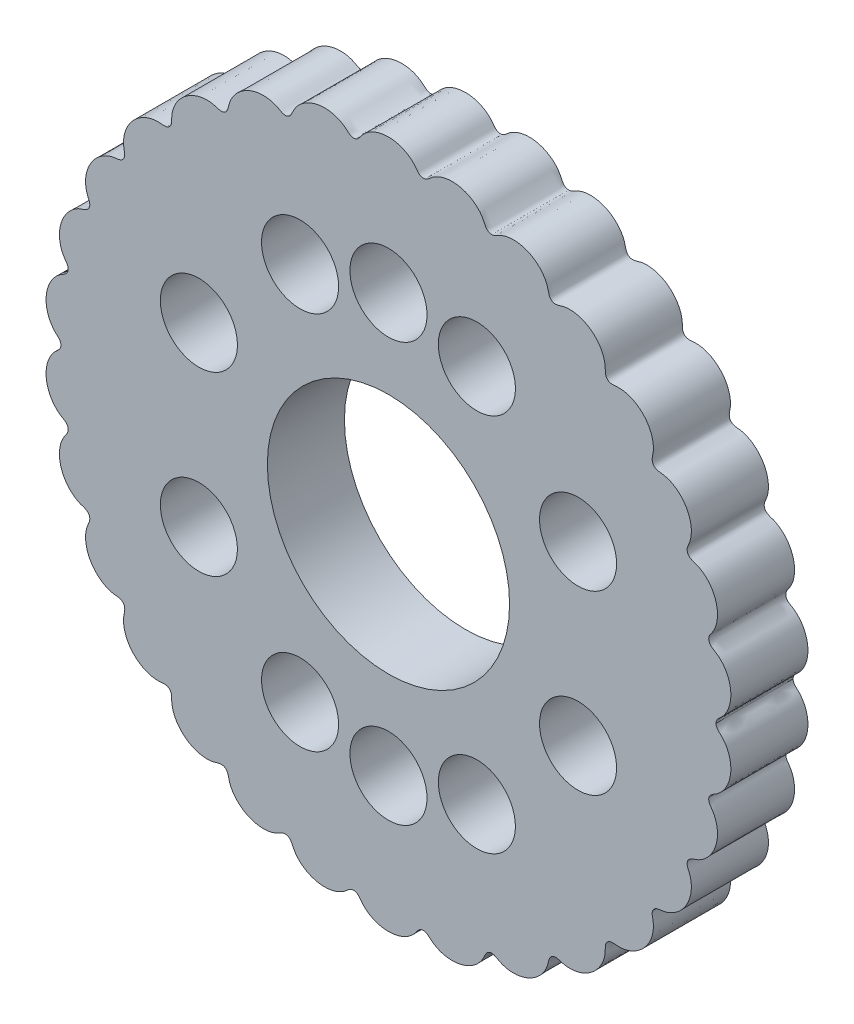
from build123d import *

# Parameters (mm, degrees)
BOSS_EXTRU_1_DEPTH      = 7
ESQUISSE2_R             = 3.5
ESQUISSE2_R_2           = 11
ENL_V_MAT_EXTRU_1_DEPTH = 45.638751691


with BuildPart() as part:
    # Esquisse1 → Boss.-Extru.1 (new body)
    with BuildSketch(Plane.XY):
        with BuildLine():
            add(Edge.make_bspline(
                [(29.75, 0), (29.75, -0.140597317), (29.868141552, -0.421461557), (30.323728325, -0.778551317), (30.756059113, -1.360631901), (31.05528351, -2.175436877), (31.1311911, -3.039210716), (30.990585079, -3.894473922), (30.697291766, -4.555148986), (30.36186421, -5.022144822), (30.060775877, -5.330577748), (29.717846033, -5.592712113), (29.328538855, -5.782182254), (29.049792204, -6.141427792), (29.111562517, -6.597079384), (29.389901644, -6.932142165), (29.605756987, -7.304556503), (29.763326521, -7.706225348), (29.890581441, -8.266803983), (29.902367273, -8.989748333), (29.697008207, -9.831679599), (29.289195496, -10.597300184), (28.696108316, -11.229222627), (28.071702237, -11.603099513), (27.513860316, -11.745290086), (27.153595417, -12.01834534), (27.094633413, -12.476886731), (27.294073027, -12.865586826), (27.433341475, -13.272169368), (27.532867261, -13.83914708), (27.496449686, -14.561800198), (27.228816643, -15.386455528), (26.764531631, -16.118443702), (26.236468325, -16.61186626), (25.745602358, -16.911413725), (25.348623221, -17.078579019), (24.930243872, -17.188384684), (24.500217935, -17.207149826), (24.083804251, -17.377842841), (23.906848881, -17.807350624), (24.015247501, -18.231768991), (24.073447524, -18.656891554), (24.062056853, -19.08873021), (23.961398047, -19.654539591), (23.689675117, -20.32471612), (23.171173996, -21.019306273), (22.608883954, -21.47280356), (22.099971556, -21.74022471), (21.559984305, -21.93443999), (20.982281642, -22.017883352), (20.416041208, -21.930735471), (19.972021705, -21.988439699), (19.688462786, -22.358972522), (19.69790625, -22.798005124), (19.673174245, -23.225799304), (19.543724586, -23.787387211), (19.229151848, -24.438621475), (18.660017359, -25.093061515), (17.946397928, -25.584588147), (17.131418747, -25.882955741), (16.410791008, -25.938043434), (15.839458095, -25.855825215), (15.437343422, -25.707694829), (14.994659593, -25.651417476), (14.623488937, -25.936605654), (14.530838201, -26.366842479), (14.424788701, -26.78151288), (14.245602688, -27.175160055), (13.933225228, -27.657279928), (13.42101245, -28.168198322), (12.672236724, -28.604290578), (11.837778732, -28.841668679), (10.972095571, -28.855360209), (10.266577085, -28.66935197), (9.778355486, -28.372966253), (9.365747914, -28.207683461), (8.932323413, -28.387404231), (8.740197599, -28.784607909), (8.556885887, -29.170933655), (8.218275705, -29.63802323), (7.675546763, -30.115566718), (6.895499115, -30.495235047), (6.046463762, -30.668270941), (5.179841061, -30.624062878), (4.494438496, -30.394918661), (4.000166127, -30.096703374), (3.68505546, -29.807717775), (3.326944679, -29.546190998), (2.861199415, -29.607519812), (2.579043887, -29.947765715), (2.239300608, -30.40625765), (1.663361794, -30.853093305), (0.860435788, -31.177849944), (3.305e-06, -31.28607424), (-0.860438264, -31.177852117), (-1.663337129, -30.853084694), (-2.239345562, -30.406277477), (-2.578974817, -29.947730674), (-2.861199778, -29.607527006), (-3.326939684, -29.546188057), (-3.685051978, -29.807717556), (-4.000165501, -30.096703111), (-4.494438307, -30.394918698), (-5.17984122, -30.624062885), (-6.046463749, -30.668270945), (-6.895499126, -30.495235047), (-7.675546761, -30.115566719), (-8.218275704, -29.638023229), (-8.556885888, -29.170933655), (-8.740197599, -28.784607909), (-8.932323413, -28.387404231), (-9.365747914, -28.207683461), (-9.778355486, -28.372966253), (-10.266577085, -28.66935197), (-10.972095571, -28.855360209), (-11.837778732, -28.841668678), (-12.672236724, -28.604290578), (-13.42101245, -28.168198322), (-13.933225228, -27.657279928), (-14.245602688, -27.175160055), (-14.424788701, -26.78151288), (-14.530838201, -26.366842479), (-14.623488937, -25.936605654), (-14.994659593, -25.651417476), (-15.437343422, -25.707694829), (-15.839458095, -25.855825215), (-16.410791008, -25.938043434), (-17.131418747, -25.882955741), (-17.946397928, -25.584588147), (-18.660017359, -25.093061515), (-19.229151848, -24.438621475), (-19.543724586, -23.787387211), (-19.673174245, -23.225799304), (-19.69790625, -22.798005124), (-19.688462786, -22.358972522), (-19.972021705, -21.988439699), (-20.416041208, -21.930735471), (-20.982281642, -22.017883352), (-21.559984305, -21.93443999), (-22.099971556, -21.74022471), (-22.608883954, -21.47280356), (-23.171173996, -21.019306273), (-23.689675117, -20.32471612), (-23.961398047, -19.654539591), (-24.062056853, -19.08873021), (-24.073447524, -18.656891554), (-24.015247501, -18.231768991), (-23.906848881, -17.807350624), (-24.083804251, -17.377842841), (-24.500217935, -17.207149826), (-24.930243872, -17.188384684), (-25.348623221, -17.078579019), (-25.745602358, -16.911413725), (-26.236468325, -16.61186626), (-26.764531631, -16.118443702), (-27.228816643, -15.386455528), (-27.496449686, -14.561800198), (-27.532867261, -13.83914708), (-27.433341475, -13.272169368), (-27.294073027, -12.865586826), (-27.094633413, -12.476886731), (-27.153595417, -12.01834534), (-27.513860316, -11.745290086), (-28.071702237, -11.603099513), (-28.696108316, -11.229222627), (-29.289195496, -10.597300184), (-29.697008207, -9.831679599), (-29.902367273, -8.989748333), (-29.890581441, -8.266803983), (-29.763326521, -7.706225348), (-29.605756987, -7.304556503), (-29.389901644, -6.932142165), (-29.111562517, -6.597079384), (-29.049792204, -6.141427792), (-29.328538855, -5.782182254), (-29.717846035, -5.592712108), (-30.060775874, -5.330577753), (-30.361864232, -5.022144787), (-30.697291735, -4.555149037), (-30.990585034, -3.894473995), (-31.131191105, -3.039210707), (-31.05528297, -2.175437752), (-30.756059941, -1.360630553), (-30.32372715, -0.778553246), (-29.868141764, -0.421461177), (-29.75, -0.140597316), (-29.75, 0)],
                knots=[0.074015259, 0.074015259, 0.074015259, 0.074015259, 0.077343265, 0.080671271, 0.087327283, 0.093983294, 0.100639306, 0.107295317, 0.113951329, 0.117279335, 0.12060734, 0.123935346, 0.127263352, 0.130591358, 0.133919364, 0.137247369, 0.140575375, 0.143903381, 0.147231387, 0.153887398, 0.16054341, 0.167199421, 0.173855433, 0.180511445, 0.18383945, 0.187167456, 0.190495462, 0.193823468, 0.197151474, 0.200479479, 0.207135491, 0.213791502, 0.220447514, 0.227103526, 0.230431531, 0.233759537, 0.237087543, 0.240415549, 0.243743555, 0.24707156, 0.250399566, 0.253727572, 0.257055578, 0.260383583, 0.267039595, 0.273695607, 0.280351618, 0.283679624, 0.28700763, 0.293663641, 0.296991647, 0.300319653, 0.303647659, 0.306975664, 0.31030367, 0.313631676, 0.320287688, 0.326943699, 0.333599711, 0.340255722, 0.346911734, 0.35023974, 0.353567745, 0.356895751, 0.360223757, 0.363551763, 0.366879769, 0.370207774, 0.37353578, 0.380191792, 0.386847803, 0.393503815, 0.400159826, 0.406815838, 0.410143844, 0.41347185, 0.416799855, 0.420127861, 0.423455867, 0.426783873, 0.433439884, 0.440095896, 0.446751907, 0.453407919, 0.460063931, 0.463391936, 0.466719942, 0.470047948, 0.473375954, 0.47670396, 0.480031965, 0.486687977, 0.493343988, 0.5, 0.506656012, 0.513312023, 0.519968035, 0.52329604, 0.526624046, 0.529952052, 0.533280058, 0.536608064, 0.539936069, 0.546592081, 0.553248093, 0.559904104, 0.566560116, 0.573216127, 0.576544133, 0.579872139, 0.583200145, 0.58652815, 0.589856156, 0.593184162, 0.599840174, 0.606496185, 0.613152197, 0.619808208, 0.62646422, 0.629792226, 0.633120231, 0.636448237, 0.639776243, 0.643104249, 0.646432255, 0.64976026, 0.653088266, 0.659744278, 0.666400289, 0.673056301, 0.679712312, 0.686368324, 0.68969633, 0.693024336, 0.696352341, 0.699680347, 0.703008353, 0.706336359, 0.71299237, 0.716320376, 0.719648382, 0.726304393, 0.732960405, 0.739616417, 0.742944422, 0.746272428, 0.749600434, 0.75292844, 0.756256445, 0.759584451, 0.762912457, 0.766240463, 0.769568469, 0.772896474, 0.779552486, 0.786208498, 0.792864509, 0.799520521, 0.802848526, 0.806176532, 0.809504538, 0.812832544, 0.81616055, 0.819488555, 0.826144567, 0.832800579, 0.83945659, 0.846112602, 0.852768613, 0.856096619, 0.859424625, 0.862752631, 0.866080636, 0.869408642, 0.872736648, 0.876064654, 0.87939266, 0.882720665, 0.886048671, 0.892704683, 0.899360694, 0.906016706, 0.912672717, 0.919328729, 0.922656735, 0.925984741, 0.925984741, 0.925984741, 0.925984741], degree=3))
            add(Edge.make_bspline(
                [(-29.75, 0), (-29.75, 0.140597316), (-29.868141764, 0.421461177), (-30.32372715, 0.778553246), (-30.756059941, 1.360630553), (-31.05528297, 2.175437752), (-31.131191105, 3.039210707), (-30.990585034, 3.894473995), (-30.697291735, 4.555149037), (-30.361864232, 5.022144787), (-30.060775874, 5.330577753), (-29.717846035, 5.592712108), (-29.328538855, 5.782182254), (-29.049792204, 6.141427792), (-29.111562517, 6.597079384), (-29.389901644, 6.932142165), (-29.605756987, 7.304556503), (-29.763326521, 7.706225348), (-29.890581441, 8.266803983), (-29.902367273, 8.989748333), (-29.697008207, 9.831679599), (-29.289195496, 10.597300184), (-28.696108316, 11.229222627), (-28.071702237, 11.603099513), (-27.513860316, 11.745290086), (-27.153595417, 12.01834534), (-27.094633413, 12.476886731), (-27.294073027, 12.865586826), (-27.433341475, 13.272169368), (-27.532867261, 13.83914708), (-27.496449686, 14.561800198), (-27.228816643, 15.386455528), (-26.764531631, 16.118443702), (-26.236468325, 16.61186626), (-25.745602358, 16.911413725), (-25.348623221, 17.078579019), (-24.930243872, 17.188384684), (-24.500217935, 17.207149826), (-24.083804251, 17.377842841), (-23.906848881, 17.807350624), (-24.015247501, 18.231768991), (-24.073447524, 18.656891554), (-24.062056853, 19.08873021), (-23.961398047, 19.654539591), (-23.689675117, 20.32471612), (-23.171173996, 21.019306273), (-22.608883954, 21.47280356), (-22.099971556, 21.74022471), (-21.559984305, 21.93443999), (-20.982281642, 22.017883352), (-20.416041208, 21.930735471), (-19.972021705, 21.988439699), (-19.688462786, 22.358972522), (-19.69790625, 22.798005124), (-19.673174245, 23.225799304), (-19.543724586, 23.787387211), (-19.229151848, 24.438621475), (-18.660017359, 25.093061515), (-17.946397928, 25.584588147), (-17.131418747, 25.882955741), (-16.410791008, 25.938043434), (-15.839458095, 25.855825215), (-15.437343422, 25.707694829), (-14.994659593, 25.651417476), (-14.623488937, 25.936605654), (-14.530838201, 26.366842479), (-14.424788701, 26.78151288), (-14.245602688, 27.175160055), (-13.933225228, 27.657279928), (-13.42101245, 28.168198322), (-12.672236724, 28.604290578), (-11.837778732, 28.841668678), (-10.972095571, 28.855360209), (-10.266577085, 28.669351969), (-9.778355486, 28.372966253), (-9.365747914, 28.207683461), (-8.932323413, 28.387404231), (-8.740197599, 28.784607909), (-8.556885888, 29.170933655), (-8.218275704, 29.638023229), (-7.675546761, 30.115566719), (-6.895499126, 30.495235047), (-6.046463749, 30.668270945), (-5.17984122, 30.624062885), (-4.494438307, 30.394918698), (-4.000165501, 30.096703111), (-3.685051978, 29.807717556), (-3.326939684, 29.546188057), (-2.861199778, 29.607527006), (-2.578974817, 29.947730674), (-2.239345562, 30.406277477), (-1.663337129, 30.853084694), (-0.860438264, 31.177852117), (3.305e-06, 31.28607424), (0.860435788, 31.177849944), (1.663361794, 30.853093305), (2.239300608, 30.40625765), (2.579043887, 29.947765715), (2.861199415, 29.607519812), (3.326944679, 29.546190998), (3.68505546, 29.807717775), (4.000166127, 30.096703374), (4.494438496, 30.394918661), (5.179841061, 30.624062878), (6.046463762, 30.668270941), (6.895499115, 30.495235047), (7.675546763, 30.115566718), (8.218275705, 29.63802323), (8.556885887, 29.170933655), (8.740197599, 28.784607909), (8.932323413, 28.387404231), (9.365747914, 28.207683461), (9.778355486, 28.372966253), (10.266577085, 28.66935197), (10.972095571, 28.855360209), (11.837778732, 28.841668678), (12.672236724, 28.604290578), (13.42101245, 28.168198322), (13.933225228, 27.657279928), (14.245602688, 27.175160055), (14.424788701, 26.78151288), (14.530838201, 26.366842479), (14.623488937, 25.936605654), (14.994659593, 25.651417476), (15.437343422, 25.707694829), (15.839458095, 25.855825215), (16.410791008, 25.938043434), (17.131418747, 25.882955741), (17.946397928, 25.584588147), (18.660017359, 25.093061515), (19.229151848, 24.438621475), (19.543724586, 23.787387211), (19.673174245, 23.225799304), (19.69790625, 22.798005124), (19.688462786, 22.358972522), (19.972021705, 21.988439699), (20.416041208, 21.930735471), (20.982281642, 22.017883352), (21.559984305, 21.93443999), (22.099971556, 21.74022471), (22.608883954, 21.47280356), (23.171173996, 21.019306273), (23.689675117, 20.32471612), (23.961398047, 19.654539591), (24.062056853, 19.08873021), (24.073447524, 18.656891554), (24.015247501, 18.231768991), (23.906848881, 17.807350624), (24.083804251, 17.377842841), (24.500217935, 17.207149826), (24.930243872, 17.188384684), (25.348623221, 17.078579019), (25.745602358, 16.911413725), (26.236468325, 16.61186626), (26.764531631, 16.118443702), (27.228816643, 15.386455528), (27.496449686, 14.561800198), (27.532867261, 13.83914708), (27.433341475, 13.272169368), (27.294073027, 12.865586826), (27.094633413, 12.476886731), (27.153595417, 12.01834534), (27.513860316, 11.745290086), (28.071702237, 11.603099513), (28.696108316, 11.229222627), (29.289195496, 10.597300184), (29.697008207, 9.831679599), (29.902367273, 8.989748333), (29.890581441, 8.266803983), (29.763326521, 7.706225348), (29.605756987, 7.304556503), (29.389901644, 6.932142165), (29.111562517, 6.597079384), (29.049792204, 6.141427792), (29.328538855, 5.782182254), (29.717846033, 5.592712113), (30.060775877, 5.330577748), (30.36186421, 5.022144822), (30.697291766, 4.555148986), (30.990585079, 3.894473922), (31.1311911, 3.039210716), (31.05528351, 2.175436877), (30.756059113, 1.360631901), (30.323728325, 0.778551317), (29.868141552, 0.421461557), (29.75, 0.140597317), (29.75, 0)],
                knots=[0.074015259, 0.074015259, 0.074015259, 0.074015259, 0.077343265, 0.080671271, 0.087327283, 0.093983294, 0.100639306, 0.107295317, 0.113951329, 0.117279335, 0.12060734, 0.123935346, 0.127263352, 0.130591358, 0.133919364, 0.137247369, 0.140575375, 0.143903381, 0.147231387, 0.153887398, 0.16054341, 0.167199421, 0.173855433, 0.180511445, 0.18383945, 0.187167456, 0.190495462, 0.193823468, 0.197151474, 0.200479479, 0.207135491, 0.213791502, 0.220447514, 0.227103526, 0.230431531, 0.233759537, 0.237087543, 0.240415549, 0.243743555, 0.24707156, 0.250399566, 0.253727572, 0.257055578, 0.260383583, 0.267039595, 0.273695607, 0.280351618, 0.283679624, 0.28700763, 0.293663641, 0.296991647, 0.300319653, 0.303647659, 0.306975664, 0.31030367, 0.313631676, 0.320287688, 0.326943699, 0.333599711, 0.340255722, 0.346911734, 0.35023974, 0.353567745, 0.356895751, 0.360223757, 0.363551763, 0.366879769, 0.370207774, 0.37353578, 0.380191792, 0.386847803, 0.393503815, 0.400159826, 0.406815838, 0.410143844, 0.41347185, 0.416799855, 0.420127861, 0.423455867, 0.426783873, 0.433439884, 0.440095896, 0.446751907, 0.453407919, 0.460063931, 0.463391936, 0.466719942, 0.470047948, 0.473375954, 0.47670396, 0.480031965, 0.486687977, 0.493343988, 0.5, 0.506656012, 0.513312023, 0.519968035, 0.52329604, 0.526624046, 0.529952052, 0.533280058, 0.536608064, 0.539936069, 0.546592081, 0.553248093, 0.559904104, 0.566560116, 0.573216127, 0.576544133, 0.579872139, 0.583200145, 0.58652815, 0.589856156, 0.593184162, 0.599840174, 0.606496185, 0.613152197, 0.619808208, 0.62646422, 0.629792226, 0.633120231, 0.636448237, 0.639776243, 0.643104249, 0.646432255, 0.64976026, 0.653088266, 0.659744278, 0.666400289, 0.673056301, 0.679712312, 0.686368324, 0.68969633, 0.693024336, 0.696352341, 0.699680347, 0.703008353, 0.706336359, 0.71299237, 0.716320376, 0.719648382, 0.726304393, 0.732960405, 0.739616417, 0.742944422, 0.746272428, 0.749600434, 0.75292844, 0.756256445, 0.759584451, 0.762912457, 0.766240463, 0.769568469, 0.772896474, 0.779552486, 0.786208498, 0.792864509, 0.799520521, 0.802848526, 0.806176532, 0.809504538, 0.812832544, 0.81616055, 0.819488555, 0.826144567, 0.832800579, 0.83945659, 0.846112602, 0.852768613, 0.856096619, 0.859424625, 0.862752631, 0.866080636, 0.869408642, 0.872736648, 0.876064654, 0.87939266, 0.882720665, 0.886048671, 0.892704683, 0.899360694, 0.906016706, 0.912672717, 0.919328729, 0.922656735, 0.925984741, 0.925984741, 0.925984741, 0.925984741], degree=3))
        make_face()
    extrude(amount=BOSS_EXTRU_1_DEPTH)

    # Esquisse2 → Enlèv. mat.-Extru.1 (cut, through all)
    with BuildSketch(Plane.XY.offset(7)):
        with Locations((-8.029746973, 17.219847954)):
            Circle(ESQUISSE2_R)
        with Locations(Location((8.029746973, 17.219847954, 0), (0, 0, 180))):
            Circle(ESQUISSE2_R)
        with Locations((17.219847954, 8.029746973)):
            Circle(ESQUISSE2_R)
        with Locations(Location((17.219847954, -8.029746973, 0), (0, 0, 180))):
            Circle(ESQUISSE2_R)
        with Locations((8.029746973, -17.219847954)):
            Circle(ESQUISSE2_R)
        with Locations(Location((-8.029746973, -17.219847954, 0), (0, 0, 180))):
            Circle(ESQUISSE2_R)
        with Locations((-17.219847954, -8.029746973)):
            Circle(ESQUISSE2_R)
        with Locations(Location((-17.219847954, 8.029746973, 0), (0, 0, 180))):
            Circle(ESQUISSE2_R)
        Circle(ESQUISSE2_R_2)
        with Locations((0, 19)):
            Circle(ESQUISSE2_R)
        with Locations((0, -19)):
            Circle(ESQUISSE2_R)
    extrude(amount=-ENL_V_MAT_EXTRU_1_DEPTH, mode=Mode.SUBTRACT)


solid = part.part
